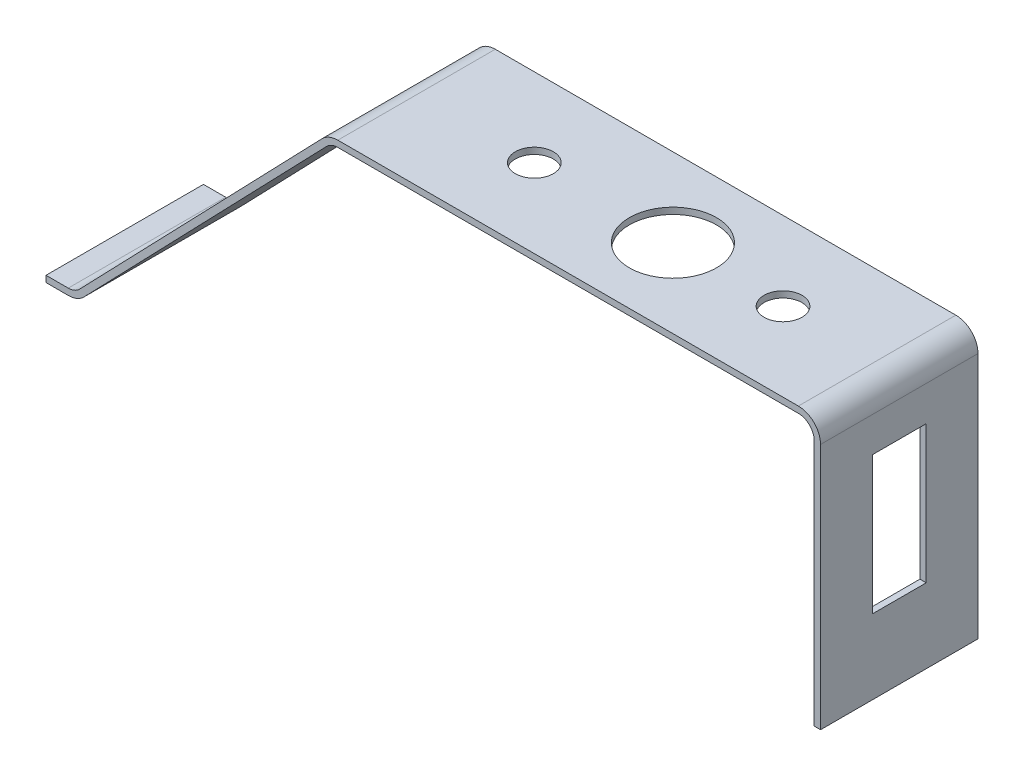
from build123d import *

# Parameters (mm, degrees)
EXTRUDE_THIN1_DEPTH = 6.3119
CUT_EXTRUDE1_REACH  = 68.051
SKETCH2_W           = 4.318
SKETCH2_H           = 11.049
CUT_EXTRUDE2_REACH  = 68.051
SKETCH3_R           = 1.524
SKETCH3_R_2         = 3.4925


with BuildPart() as part:
    # Sketch1 → Extrude-Thin1 (new, symmetric)
    with BuildSketch(Plane.XY):
        with BuildLine():
            Line((0, 0), (1.784287341, 0))
            ThreePointArc((1.784287341, 0), (2.479784243, 0.141672386), (3.064445706, 0.54411242))
            Line((3.064445706, 0.54411242), (22.485395925, 20.693348272))
            ThreePointArc((22.485395925, 20.693348272), (22.903011255, 20.980805438), (23.399794757, 21.082))
            Line((23.399794757, 21.082), (60.325, 21.082))
            ThreePointArc((60.325, 21.082), (61.223025612, 20.710025612), (61.595, 19.812))
            Line((61.595, 19.812), (61.595, 0))
            Line((61.595, 0), (62.103, 0))
            Line((62.103, 0), (62.103, 19.812))
            ThreePointArc((62.103, 19.812), (61.582235857, 21.069235857), (60.325, 21.59))
            Line((60.325, 21.59), (23.399794757, 21.59))
            ThreePointArc((23.399794757, 21.59), (22.704297854, 21.448327614), (22.119636392, 21.04588758))
            Line((22.119636392, 21.04588758), (2.698686173, 0.896651728))
            ThreePointArc((2.698686173, 0.896651728), (2.281070842, 0.609194562), (1.784287341, 0.508))
            Line((1.784287341, 0.508), (0, 0.508))
            Line((0, 0.508), (0, 0))
        make_face()
    extrude(amount=EXTRUDE_THIN1_DEPTH, both=True)

    # Sketch2 → Cut-Extrude1 (cut, up to next)
    with BuildSketch(Plane(origin=(62.103, 0, 0), x_dir=(0, 0, -1), z_dir=(1, 0, 0)), mode=Mode.PRIVATE) as cut_extrude1_sk1:
        with Locations((0, 11.4935)):
            Rectangle(SKETCH2_W, SKETCH2_H)
    cut_extrude1_tool1 = extrude(cut_extrude1_sk1.sketch, amount=-CUT_EXTRUDE1_REACH, mode=Mode.PRIVATE) & part.part
    add(cut_extrude1_tool1.solids().sort_by_distance((62.103, 11.4935, 0))[0], mode=Mode.SUBTRACT)

    # Sketch3 → Cut-Extrude2 (cut, up to next)
    with BuildSketch(Plane(origin=(0, 21.59, 0), x_dir=(1, 0, 0), z_dir=(0, 1, 0)), mode=Mode.PRIVATE) as cut_extrude2_sk1:
        with Locations((52.7812, 0)):
            Circle(SKETCH3_R)
    cut_extrude2_tool1 = extrude(cut_extrude2_sk1.sketch, amount=-CUT_EXTRUDE2_REACH, mode=Mode.PRIVATE) & part.part
    # Sketch3 → Cut-Extrude2 (cut, up to next)
    with BuildSketch(Plane(origin=(0, 21.59, 0), x_dir=(1, 0, 0), z_dir=(0, 1, 0)), mode=Mode.PRIVATE) as cut_extrude2_sk2:
        with Locations((32.8422, 0)):
            Circle(SKETCH3_R)
    cut_extrude2_tool2 = extrude(cut_extrude2_sk2.sketch, amount=-CUT_EXTRUDE2_REACH, mode=Mode.PRIVATE) & part.part
    # Sketch3 → Cut-Extrude2 (cut, up to next)
    with BuildSketch(Plane(origin=(0, 21.59, 0), x_dir=(1, 0, 0), z_dir=(0, 1, 0)), mode=Mode.PRIVATE) as cut_extrude2_sk3:
        with Locations((43.9547, 0)):
            Circle(SKETCH3_R_2)
    cut_extrude2_tool3 = extrude(cut_extrude2_sk3.sketch, amount=-CUT_EXTRUDE2_REACH, mode=Mode.PRIVATE) & part.part
    add(cut_extrude2_tool1.solids().sort_by_distance((52.7812, 21.59, 0))[0], mode=Mode.SUBTRACT)
    add(cut_extrude2_tool2.solids().sort_by_distance((32.8422, 21.59, 0))[0], mode=Mode.SUBTRACT)
    add(cut_extrude2_tool3.solids().sort_by_distance((43.9547, 21.59, 0))[0], mode=Mode.SUBTRACT)


solid = part.part
